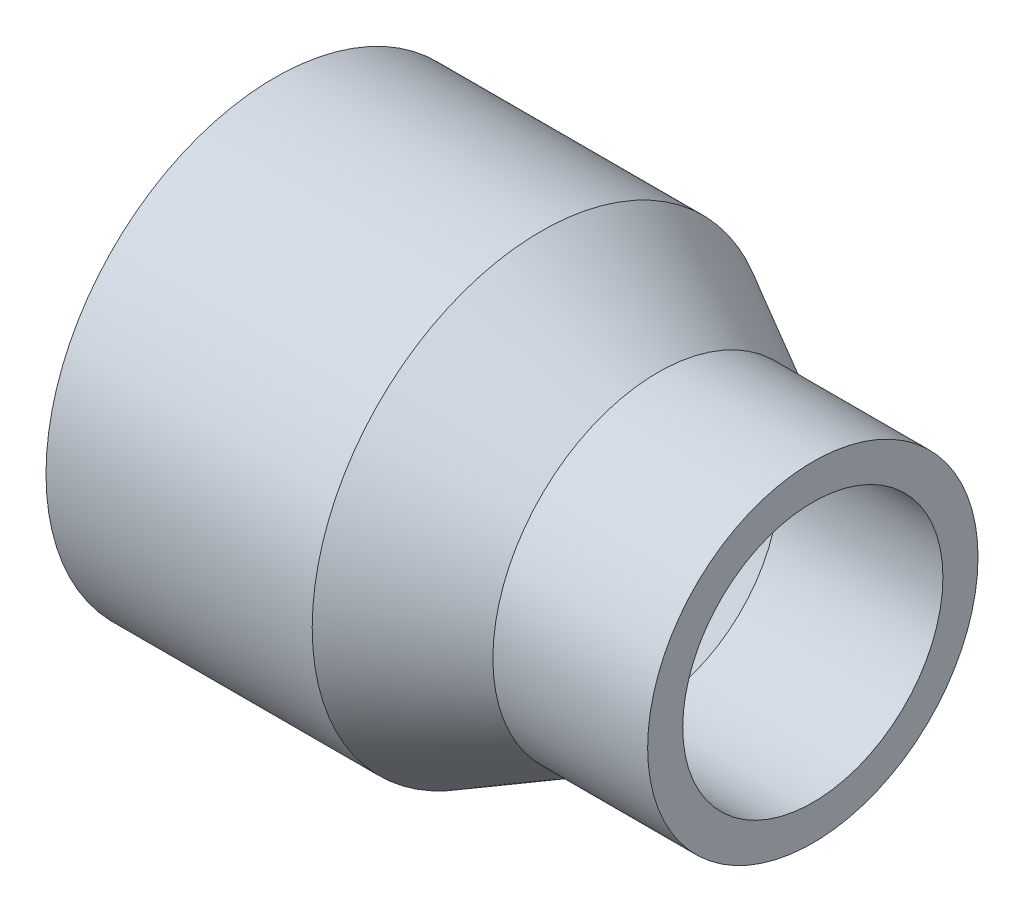
from build123d import *

# Parameters (mm, degrees)
BOSS_EXTRUDE1_START = 10
SKETCH2_R           = 19.575
SKETCH2_R_2         = 17.1
BOSS_EXTRUDE1_DEPTH = 10


with BuildPart() as part:
    # Sketch1 → Revolve1 (revolve)
    with BuildSketch(Plane(origin=(0, 0, 0), x_dir=(1, 0, 0), z_dir=(0, 1, 0)), mode=Mode.PRIVATE) as revolve1_sk:
        Polygon((0, 16.575), (12, 16.575), (22, 11.125), (36, 11.125), (36, 14.125), (22.764422316, 14.125), (12.764422316, 19.575), (0, 19.575), align=None)
    revolve(revolve1_sk.sketch.rotate(Axis((0, 0, 0), (1, 0, 0)), 180), axis=Axis((0, 0, 0), (1, 0, 0)))

    # Sketch2 → Boss-Extrude1 (add)
    with BuildSketch(Plane.ZY.offset(BOSS_EXTRUDE1_START)):
        Circle(SKETCH2_R)
        Circle(SKETCH2_R_2, mode=Mode.SUBTRACT)
    extrude(amount=-BOSS_EXTRUDE1_DEPTH)


solid = part.part
